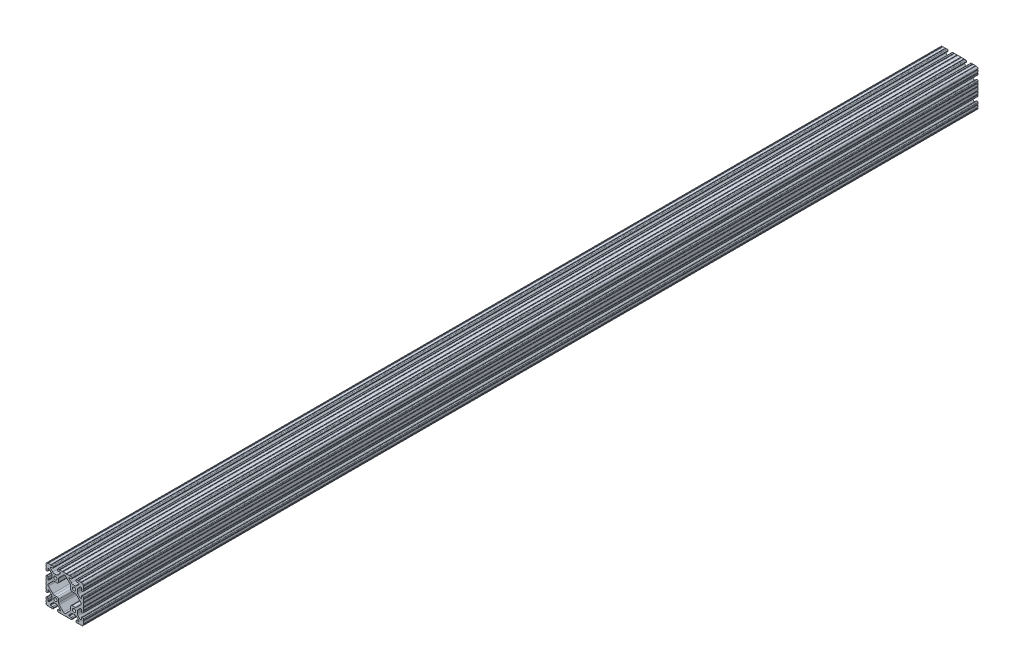
from build123d import *

# Parameters (mm, degrees)
SKETCH1_R           = 3.3274
BOSS_EXTRUDE1_DEPTH = 1828.8


with BuildPart() as part:
    # Sketch1 → Boss-Extrude1 (new body)
    with BuildSketch(Plane.XY):
        with BuildLine():
            Line((-38.1, 3.2004), (-38.1, -3.2004))
            ThreePointArc((-38.1, -3.2004), (-37.338, -3.9624), (-38.1, -4.7244))
            Line((-38.1, -4.7244), (-38.1, -9.5504))
            ThreePointArc((-38.1, -9.5504), (-37.338, -10.3124), (-38.1, -11.0744))
            Line((-38.1, -11.0744), (-38.1, -13.4112))
            ThreePointArc((-38.1, -13.4112), (-37.638751759, -14.524751759), (-36.5252, -14.986))
            Line((-36.5252, -14.986), (-35.6108, -14.986))
            ThreePointArc((-35.6108, -14.986), (-34.497248241, -14.524751759), (-34.036, -13.4112))
            Line((-34.036, -13.4112), (-34.036, -9.652))
            ThreePointArc((-34.036, -9.652), (-33.775617928, -9.023382072), (-33.147, -8.763))
            Line((-33.147, -8.763), (-32.578918, -8.763))
            ThreePointArc((-32.578918, -8.763), (-32.238712428, -8.830671096), (-31.950300071, -9.023382072))
            Line((-31.950300071, -9.023382072), (-27.179198975, -13.794483168))
            ThreePointArc((-27.179198975, -13.794483168), (-26.14957176, -15.33542919), (-25.788014764, -17.153098957))
            Line((-25.788014764, -17.153098957), (-25.788014764, -20.946901043))
            ThreePointArc((-25.788014764, -20.946901043), (-26.14957176, -22.76457081), (-27.179198975, -24.305516832))
            Line((-27.179198975, -24.305516832), (-31.950300071, -29.076617928))
            ThreePointArc((-31.950300071, -29.076617928), (-32.238712428, -29.269328904), (-32.578918, -29.337))
            Line((-32.578918, -29.337), (-33.147, -29.337))
            ThreePointArc((-33.147, -29.337), (-33.775617928, -29.076617928), (-34.036, -28.448))
            Line((-34.036, -28.448), (-34.036, -24.6888))
            ThreePointArc((-34.036, -24.6888), (-34.497248241, -23.575248241), (-35.6108, -23.114))
            Line((-35.6108, -23.114), (-36.5252, -23.114))
            ThreePointArc((-36.5252, -23.114), (-37.638751759, -23.575248241), (-38.1, -24.6888))
            Line((-38.1, -24.6888), (-38.1, -27.0256))
            ThreePointArc((-38.1, -27.0256), (-37.338, -27.7876), (-38.1, -28.5496))
            Line((-38.1, -28.5496), (-38.1, -33.3756))
            ThreePointArc((-38.1, -33.3756), (-37.338, -34.1376), (-38.1, -34.8996))
            Line((-38.1, -34.8996), (-38.1, -34.925))
            ThreePointArc((-38.1, -34.925), (-37.17006403, -37.17006403), (-34.925, -38.1))
            Line((-34.925, -38.1), (-34.8996, -38.1))
            ThreePointArc((-34.8996, -38.1), (-34.1376, -37.338), (-33.3756, -38.1))
            Line((-33.3756, -38.1), (-28.5496, -38.1))
            ThreePointArc((-28.5496, -38.1), (-27.7876, -37.338), (-27.0256, -38.1))
            Line((-27.0256, -38.1), (-24.6888, -38.1))
            ThreePointArc((-24.6888, -38.1), (-23.575248241, -37.638751759), (-23.114, -36.5252))
            Line((-23.114, -36.5252), (-23.114, -35.6108))
            ThreePointArc((-23.114, -35.6108), (-23.575248241, -34.497248241), (-24.6888, -34.036))
            Line((-24.6888, -34.036), (-28.448, -34.036))
            ThreePointArc((-28.448, -34.036), (-29.076617928, -33.775617928), (-29.337, -33.147))
            Line((-29.337, -33.147), (-29.337, -32.578918))
            ThreePointArc((-29.337, -32.578918), (-29.269328904, -32.238712428), (-29.076617928, -31.950300071))
            Line((-29.076617928, -31.950300071), (-24.305516832, -27.179198975))
            ThreePointArc((-24.305516832, -27.179198975), (-22.76457081, -26.14957176), (-20.946901043, -25.788014764))
            Line((-20.946901043, -25.788014764), (-17.153098957, -25.788014764))
            ThreePointArc((-17.153098957, -25.788014764), (-15.33542919, -26.14957176), (-13.794483168, -27.179198975))
            Line((-13.794483168, -27.179198975), (-9.023382072, -31.950300071))
            ThreePointArc((-9.023382072, -31.950300071), (-8.830671096, -32.238712428), (-8.763, -32.578918))
            Line((-8.763, -32.578918), (-8.763, -33.147))
            ThreePointArc((-8.763, -33.147), (-9.023382072, -33.775617928), (-9.652, -34.036))
            Line((-9.652, -34.036), (-13.4112, -34.036))
            ThreePointArc((-13.4112, -34.036), (-14.524751759, -34.497248241), (-14.986, -35.6108))
            Line((-14.986, -35.6108), (-14.986, -36.5252))
            ThreePointArc((-14.986, -36.5252), (-14.524751759, -37.638751759), (-13.4112, -38.1))
            Line((-13.4112, -38.1), (-11.0744, -38.1))
            ThreePointArc((-11.0744, -38.1), (-10.3124, -37.338), (-9.5504, -38.1))
            Line((-9.5504, -38.1), (-4.7244, -38.1))
            ThreePointArc((-4.7244, -38.1), (-3.9624, -37.338), (-3.2004, -38.1))
            Line((-3.2004, -38.1), (3.2004, -38.1))
            ThreePointArc((3.2004, -38.1), (3.9624, -37.338), (4.7244, -38.1))
            Line((4.7244, -38.1), (9.5504, -38.1))
            ThreePointArc((9.5504, -38.1), (10.3124, -37.338), (11.0744, -38.1))
            Line((11.0744, -38.1), (13.4112, -38.1))
            ThreePointArc((13.4112, -38.1), (14.524751759, -37.638751759), (14.986, -36.5252))
            Line((14.986, -36.5252), (14.986, -35.6108))
            ThreePointArc((14.986, -35.6108), (14.524751759, -34.497248241), (13.4112, -34.036))
            Line((13.4112, -34.036), (9.652, -34.036))
            ThreePointArc((9.652, -34.036), (9.023382072, -33.775617928), (8.763, -33.147))
            Line((8.763, -33.147), (8.763, -32.578918))
            ThreePointArc((8.763, -32.578918), (8.830671096, -32.238712428), (9.023382072, -31.950300071))
            Line((9.023382072, -31.950300071), (13.794483168, -27.179198975))
            ThreePointArc((13.794483168, -27.179198975), (15.33542919, -26.14957176), (17.153098957, -25.788014764))
            Line((17.153098957, -25.788014764), (20.946901043, -25.788014764))
            ThreePointArc((20.946901043, -25.788014764), (22.76457081, -26.14957176), (24.305516832, -27.179198975))
            Line((24.305516832, -27.179198975), (29.076617928, -31.950300071))
            ThreePointArc((29.076617928, -31.950300071), (29.269328904, -32.238712428), (29.337, -32.578918))
            Line((29.337, -32.578918), (29.337, -33.147))
            ThreePointArc((29.337, -33.147), (29.076617928, -33.775617928), (28.448, -34.036))
            Line((28.448, -34.036), (24.6888, -34.036))
            ThreePointArc((24.6888, -34.036), (23.575248241, -34.497248241), (23.114, -35.6108))
            Line((23.114, -35.6108), (23.114, -36.5252))
            ThreePointArc((23.114, -36.5252), (23.575248241, -37.638751759), (24.6888, -38.1))
            Line((24.6888, -38.1), (27.0256, -38.1))
            ThreePointArc((27.0256, -38.1), (27.7876, -37.338), (28.5496, -38.1))
            Line((28.5496, -38.1), (33.3756, -38.1))
            ThreePointArc((33.3756, -38.1), (34.1376, -37.338), (34.8996, -38.1))
            Line((34.8996, -38.1), (34.925, -38.1))
            ThreePointArc((34.925, -38.1), (37.17006403, -37.17006403), (38.1, -34.925))
            Line((38.1, -34.925), (38.1, -34.8996))
            ThreePointArc((38.1, -34.8996), (37.338, -34.1376), (38.1, -33.3756))
            Line((38.1, -33.3756), (38.1, -28.5496))
            ThreePointArc((38.1, -28.5496), (37.338, -27.7876), (38.1, -27.0256))
            Line((38.1, -27.0256), (38.1, -24.6888))
            ThreePointArc((38.1, -24.6888), (37.638751759, -23.575248241), (36.5252, -23.114))
            Line((36.5252, -23.114), (35.6108, -23.114))
            ThreePointArc((35.6108, -23.114), (34.497248241, -23.575248241), (34.036, -24.6888))
            Line((34.036, -24.6888), (34.036, -28.448))
            ThreePointArc((34.036, -28.448), (33.775617928, -29.076617928), (33.147, -29.337))
            Line((33.147, -29.337), (32.578918, -29.337))
            ThreePointArc((32.578918, -29.337), (32.238712428, -29.269328904), (31.950300071, -29.076617928))
            Line((31.950300071, -29.076617928), (27.179198975, -24.305516832))
            ThreePointArc((27.179198975, -24.305516832), (26.14957176, -22.76457081), (25.788014764, -20.946901043))
            Line((25.788014764, -20.946901043), (25.788014764, -17.153098957))
            ThreePointArc((25.788014764, -17.153098957), (26.14957176, -15.33542919), (27.179198975, -13.794483168))
            Line((27.179198975, -13.794483168), (31.950300071, -9.023382072))
            ThreePointArc((31.950300071, -9.023382072), (32.238712428, -8.830671096), (32.578918, -8.763))
            Line((32.578918, -8.763), (33.147, -8.763))
            ThreePointArc((33.147, -8.763), (33.775617928, -9.023382072), (34.036, -9.652))
            Line((34.036, -9.652), (34.036, -13.4112))
            ThreePointArc((34.036, -13.4112), (34.497248241, -14.524751759), (35.6108, -14.986))
            Line((35.6108, -14.986), (36.5252, -14.986))
            ThreePointArc((36.5252, -14.986), (37.638751759, -14.524751759), (38.1, -13.4112))
            Line((38.1, -13.4112), (38.1, -11.0744))
            ThreePointArc((38.1, -11.0744), (37.338, -10.3124), (38.1, -9.5504))
            Line((38.1, -9.5504), (38.1, -4.7244))
            ThreePointArc((38.1, -4.7244), (37.338, -3.9624), (38.1, -3.2004))
            Line((38.1, -3.2004), (38.1, 3.2004))
            ThreePointArc((38.1, 3.2004), (37.338, 3.9624), (38.1, 4.7244))
            Line((38.1, 4.7244), (38.1, 9.5504))
            ThreePointArc((38.1, 9.5504), (37.338, 10.3124), (38.1, 11.0744))
            Line((38.1, 11.0744), (38.1, 13.4112))
            ThreePointArc((38.1, 13.4112), (37.638751759, 14.524751759), (36.5252, 14.986))
            Line((36.5252, 14.986), (35.6108, 14.986))
            ThreePointArc((35.6108, 14.986), (34.497248241, 14.524751759), (34.036, 13.4112))
            Line((34.036, 13.4112), (34.036, 9.652))
            ThreePointArc((34.036, 9.652), (33.775617928, 9.023382072), (33.147, 8.763))
            Line((33.147, 8.763), (32.578918, 8.763))
            ThreePointArc((32.578918, 8.763), (32.238712428, 8.830671096), (31.950300071, 9.023382072))
            Line((31.950300071, 9.023382072), (27.179198975, 13.794483168))
            ThreePointArc((27.179198975, 13.794483168), (26.14957176, 15.33542919), (25.788014764, 17.153098957))
            Line((25.788014764, 17.153098957), (25.788014764, 20.946901043))
            ThreePointArc((25.788014764, 20.946901043), (26.14957176, 22.76457081), (27.179198975, 24.305516832))
            Line((27.179198975, 24.305516832), (31.950300071, 29.076617928))
            ThreePointArc((31.950300071, 29.076617928), (32.238712428, 29.269328904), (32.578918, 29.337))
            Line((32.578918, 29.337), (33.147, 29.337))
            ThreePointArc((33.147, 29.337), (33.775617928, 29.076617928), (34.036, 28.448))
            Line((34.036, 28.448), (34.036, 24.6888))
            ThreePointArc((34.036, 24.6888), (34.497248241, 23.575248241), (35.6108, 23.114))
            Line((35.6108, 23.114), (36.5252, 23.114))
            ThreePointArc((36.5252, 23.114), (37.638751759, 23.575248241), (38.1, 24.6888))
            Line((38.1, 24.6888), (38.1, 27.0256))
            ThreePointArc((38.1, 27.0256), (37.338, 27.7876), (38.1, 28.5496))
            Line((38.1, 28.5496), (38.1, 33.3756))
            ThreePointArc((38.1, 33.3756), (37.338, 34.1376), (38.1, 34.8996))
            Line((38.1, 34.8996), (38.1, 34.925))
            ThreePointArc((38.1, 34.925), (37.17006403, 37.17006403), (34.925, 38.1))
            Line((34.925, 38.1), (34.8996, 38.1))
            ThreePointArc((34.8996, 38.1), (34.1376, 37.338), (33.3756, 38.1))
            Line((33.3756, 38.1), (28.5496, 38.1))
            ThreePointArc((28.5496, 38.1), (27.7876, 37.338), (27.0256, 38.1))
            Line((27.0256, 38.1), (24.6888, 38.1))
            ThreePointArc((24.6888, 38.1), (23.575248241, 37.638751759), (23.114, 36.5252))
            Line((23.114, 36.5252), (23.114, 35.6108))
            ThreePointArc((23.114, 35.6108), (23.575248241, 34.497248241), (24.6888, 34.036))
            Line((24.6888, 34.036), (28.448, 34.036))
            ThreePointArc((28.448, 34.036), (29.076617928, 33.775617928), (29.337, 33.147))
            Line((29.337, 33.147), (29.337, 32.578918))
            ThreePointArc((29.337, 32.578918), (29.269328904, 32.238712428), (29.076617928, 31.950300071))
            Line((29.076617928, 31.950300071), (24.305516832, 27.179198975))
            ThreePointArc((24.305516832, 27.179198975), (22.76457081, 26.14957176), (20.946901043, 25.788014764))
            Line((20.946901043, 25.788014764), (17.153098957, 25.788014764))
            ThreePointArc((17.153098957, 25.788014764), (15.33542919, 26.14957176), (13.794483168, 27.179198975))
            Line((13.794483168, 27.179198975), (9.023382072, 31.950300071))
            ThreePointArc((9.023382072, 31.950300071), (8.830671096, 32.238712428), (8.763, 32.578918))
            Line((8.763, 32.578918), (8.763, 33.147))
            ThreePointArc((8.763, 33.147), (9.023382072, 33.775617928), (9.652, 34.036))
            Line((9.652, 34.036), (13.4112, 34.036))
            ThreePointArc((13.4112, 34.036), (14.524751759, 34.497248241), (14.986, 35.6108))
            Line((14.986, 35.6108), (14.986, 36.5252))
            ThreePointArc((14.986, 36.5252), (14.524751759, 37.638751759), (13.4112, 38.1))
            Line((13.4112, 38.1), (11.0744, 38.1))
            ThreePointArc((11.0744, 38.1), (10.3124, 37.338), (9.5504, 38.1))
            Line((9.5504, 38.1), (4.7244, 38.1))
            ThreePointArc((4.7244, 38.1), (3.9624, 37.338), (3.2004, 38.1))
            Line((3.2004, 38.1), (-3.2004, 38.1))
            ThreePointArc((-3.2004, 38.1), (-3.9624, 37.338), (-4.7244, 38.1))
            Line((-4.7244, 38.1), (-9.5504, 38.1))
            ThreePointArc((-9.5504, 38.1), (-10.3124, 37.338), (-11.0744, 38.1))
            Line((-11.0744, 38.1), (-13.4112, 38.1))
            ThreePointArc((-13.4112, 38.1), (-14.524751759, 37.638751759), (-14.986, 36.5252))
            Line((-14.986, 36.5252), (-14.986, 35.6108))
            ThreePointArc((-14.986, 35.6108), (-14.524751759, 34.497248241), (-13.4112, 34.036))
            Line((-13.4112, 34.036), (-9.652, 34.036))
            ThreePointArc((-9.652, 34.036), (-9.023382072, 33.775617928), (-8.763, 33.147))
            Line((-8.763, 33.147), (-8.763, 32.578918))
            ThreePointArc((-8.763, 32.578918), (-8.830671096, 32.238712428), (-9.023382072, 31.950300071))
            Line((-9.023382072, 31.950300071), (-13.794483168, 27.179198975))
            ThreePointArc((-13.794483168, 27.179198975), (-15.33542919, 26.14957176), (-17.153098957, 25.788014764))
            Line((-17.153098957, 25.788014764), (-20.946901043, 25.788014764))
            ThreePointArc((-20.946901043, 25.788014764), (-22.76457081, 26.14957176), (-24.305516832, 27.179198975))
            Line((-24.305516832, 27.179198975), (-29.076617928, 31.950300071))
            ThreePointArc((-29.076617928, 31.950300071), (-29.269328904, 32.238712428), (-29.337, 32.578918))
            Line((-29.337, 32.578918), (-29.337, 33.147))
            ThreePointArc((-29.337, 33.147), (-29.076617928, 33.775617928), (-28.448, 34.036))
            Line((-28.448, 34.036), (-24.6888, 34.036))
            ThreePointArc((-24.6888, 34.036), (-23.575248241, 34.497248241), (-23.114, 35.6108))
            Line((-23.114, 35.6108), (-23.114, 36.5252))
            ThreePointArc((-23.114, 36.5252), (-23.575248241, 37.638751759), (-24.6888, 38.1))
            Line((-24.6888, 38.1), (-27.0256, 38.1))
            ThreePointArc((-27.0256, 38.1), (-27.7876, 37.338), (-28.5496, 38.1))
            Line((-28.5496, 38.1), (-33.3756, 38.1))
            ThreePointArc((-33.3756, 38.1), (-34.1376, 37.338), (-34.8996, 38.1))
            Line((-34.8996, 38.1), (-34.925, 38.1))
            ThreePointArc((-34.925, 38.1), (-37.17006403, 37.17006403), (-38.1, 34.925))
            Line((-38.1, 34.925), (-38.1, 34.8996))
            ThreePointArc((-38.1, 34.8996), (-37.338, 34.1376), (-38.1, 33.3756))
            Line((-38.1, 33.3756), (-38.1, 28.5496))
            ThreePointArc((-38.1, 28.5496), (-37.338, 27.7876), (-38.1, 27.0256))
            Line((-38.1, 27.0256), (-38.1, 24.6888))
            ThreePointArc((-38.1, 24.6888), (-37.638751759, 23.575248241), (-36.5252, 23.114))
            Line((-36.5252, 23.114), (-35.6108, 23.114))
            ThreePointArc((-35.6108, 23.114), (-34.497248241, 23.575248241), (-34.036, 24.6888))
            Line((-34.036, 24.6888), (-34.036, 28.448))
            ThreePointArc((-34.036, 28.448), (-33.775617928, 29.076617928), (-33.147, 29.337))
            Line((-33.147, 29.337), (-32.578918, 29.337))
            ThreePointArc((-32.578918, 29.337), (-32.238712428, 29.269328904), (-31.950300071, 29.076617928))
            Line((-31.950300071, 29.076617928), (-27.179198975, 24.305516832))
            ThreePointArc((-27.179198975, 24.305516832), (-26.14957176, 22.76457081), (-25.788014764, 20.946901043))
            Line((-25.788014764, 20.946901043), (-25.788014764, 17.153098957))
            ThreePointArc((-25.788014764, 17.153098957), (-26.14957176, 15.33542919), (-27.179198975, 13.794483168))
            Line((-27.179198975, 13.794483168), (-31.950300071, 9.023382072))
            ThreePointArc((-31.950300071, 9.023382072), (-32.238712428, 8.830671096), (-32.578918, 8.763))
            Line((-32.578918, 8.763), (-33.147, 8.763))
            ThreePointArc((-33.147, 8.763), (-33.775617928, 9.023382072), (-34.036, 9.652))
            Line((-34.036, 9.652), (-34.036, 13.4112))
            ThreePointArc((-34.036, 13.4112), (-34.497248241, 14.524751759), (-35.6108, 14.986))
            Line((-35.6108, 14.986), (-36.5252, 14.986))
            ThreePointArc((-36.5252, 14.986), (-37.638751759, 14.524751759), (-38.1, 13.4112))
            Line((-38.1, 13.4112), (-38.1, 11.0744))
            ThreePointArc((-38.1, 11.0744), (-37.338, 10.3124), (-38.1, 9.5504))
            Line((-38.1, 9.5504), (-38.1, 4.7244))
            ThreePointArc((-38.1, 4.7244), (-37.338, 3.9624), (-38.1, 3.2004))
        make_face()
        with Locations((-19.05, 19.05)):
            Circle(SKETCH1_R, mode=Mode.SUBTRACT)
        with Locations((-19.05, -19.05)):
            Circle(SKETCH1_R, mode=Mode.SUBTRACT)
        with Locations((19.05, -19.05)):
            Circle(SKETCH1_R, mode=Mode.SUBTRACT)
        with Locations((19.05, 19.05)):
            Circle(SKETCH1_R, mode=Mode.SUBTRACT)
        with BuildLine():
            Line((15.48698542, 12.311985236), (20.946901043, 12.311985236))
            ThreePointArc((20.946901043, 12.311985236), (22.76457081, 11.95042824), (24.305516832, 10.920801025))
            Line((24.305516832, 10.920801025), (33.160858949, 2.065458908))
            ThreePointArc((33.160858949, 2.065458908), (34.016400041, 0), (33.160858949, -2.065458908))
            Line((33.160858949, -2.065458908), (24.305516832, -10.920801025))
            ThreePointArc((24.305516832, -10.920801025), (22.76457081, -11.95042824), (20.946901043, -12.311985236))
            Line((20.946901043, -12.311985236), (15.48698542, -12.311985236))
            ThreePointArc((15.48698542, -12.311985236), (13.24192139, -13.241921206), (12.31198542, -15.486985236))
            Line((12.31198542, -15.486985236), (12.31198542, -20.946901043))
            ThreePointArc((12.31198542, -20.946901043), (11.950428424, -22.76457081), (10.920801209, -24.305516832))
            Line((10.920801209, -24.305516832), (2.065458908, -33.160859133))
            ThreePointArc((2.065458908, -33.160859133), (0, -34.016400226), (-2.065458908, -33.160859133))
            Line((-2.065458908, -33.160859133), (-10.920801209, -24.305516832))
            ThreePointArc((-10.920801209, -24.305516832), (-11.950428424, -22.76457081), (-12.31198542, -20.946901043))
            Line((-12.31198542, -20.946901043), (-12.31198542, -15.486985236))
            ThreePointArc((-12.31198542, -15.486985236), (-13.24192139, -13.241921206), (-15.48698542, -12.311985236))
            Line((-15.48698542, -12.311985236), (-20.946901043, -12.311985236))
            ThreePointArc((-20.946901043, -12.311985236), (-22.76457081, -11.95042824), (-24.305516832, -10.920801025))
            Line((-24.305516832, -10.920801025), (-33.160858949, -2.065458908))
            ThreePointArc((-33.160858949, -2.065458908), (-34.016400041, 0), (-33.160858949, 2.065458908))
            Line((-33.160858949, 2.065458908), (-24.305516832, 10.920801025))
            ThreePointArc((-24.305516832, 10.920801025), (-22.76457081, 11.95042824), (-20.946901043, 12.311985236))
            Line((-20.946901043, 12.311985236), (-15.48698542, 12.311985236))
            ThreePointArc((-15.48698542, 12.311985236), (-13.24192139, 13.241921206), (-12.31198542, 15.486985236))
            Line((-12.31198542, 15.486985236), (-12.31198542, 20.946901043))
            ThreePointArc((-12.31198542, 20.946901043), (-11.950428424, 22.76457081), (-10.920801209, 24.305516832))
            Line((-10.920801209, 24.305516832), (-2.065458908, 33.160859133))
            ThreePointArc((-2.065458908, 33.160859133), (0, 34.016400226), (2.065458908, 33.160859133))
            Line((2.065458908, 33.160859133), (10.920801209, 24.305516832))
            ThreePointArc((10.920801209, 24.305516832), (11.950428424, 22.76457081), (12.31198542, 20.946901043))
            Line((12.31198542, 20.946901043), (12.31198542, 15.486985236))
            ThreePointArc((12.31198542, 15.486985236), (13.24192139, 13.241921206), (15.48698542, 12.311985236))
        make_face(mode=Mode.SUBTRACT)
    extrude(amount=BOSS_EXTRUDE1_DEPTH)


solid = part.part
